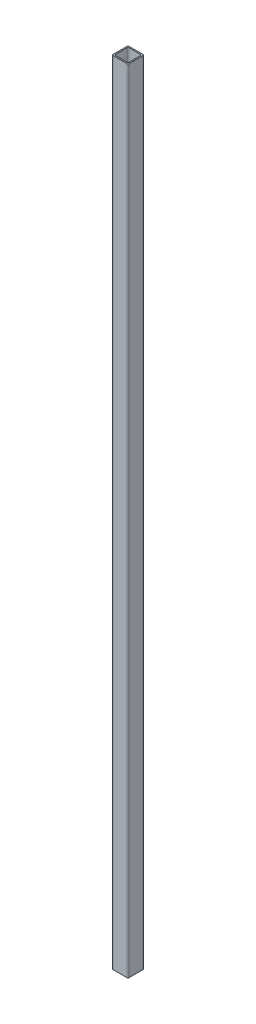
from build123d import *

# Parameters (mm, degrees)
BOSS_EXTRUDE1_DEPTH = 1210
SKETCH2_W           = 101.895059676
SKETCH2_H           = 138.127514373
CUT_EXTRUDE1_DEPTH  = 220


with BuildPart() as part:
    # Sketch1 → Boss-Extrude1 (new body)
    with BuildSketch(Plane(origin=(0, 0, 0), x_dir=(1, 0, 0), z_dir=(0, 1, 0))):
        with BuildLine():
            Line((-9, -10), (9, -10))
            ThreePointArc((9, -10), (9.707106781, -9.707106781), (10, -9))
            Line((10, -9), (10, 9))
            ThreePointArc((10, 9), (9.707106781, 9.707106781), (9, 10))
            Line((9, 10), (-9, 10))
            ThreePointArc((-9, 10), (-9.707106781, 9.707106781), (-10, 9))
            Line((-10, 9), (-10, -9))
            ThreePointArc((-10, -9), (-9.707106781, -9.707106781), (-9, -10))
        make_face()
        with BuildLine():
            Line((-7.5, -8.5), (7.5, -8.5))
            ThreePointArc((7.5, -8.5), (8.207106781, -8.207106781), (8.5, -7.5))
            Line((8.5, -7.5), (8.5, 7.5))
            ThreePointArc((8.5, 7.5), (8.207106781, 8.207106781), (7.5, 8.5))
            Line((7.5, 8.5), (-7.5, 8.5))
            ThreePointArc((-7.5, 8.5), (-8.207106781, 8.207106781), (-8.5, 7.5))
            Line((-8.5, 7.5), (-8.5, -7.5))
            ThreePointArc((-8.5, -7.5), (-8.207106781, -8.207106781), (-7.5, -8.5))
        make_face(mode=Mode.SUBTRACT)
    extrude(amount=BOSS_EXTRUDE1_DEPTH)

    # Sketch2 → Cut-Extrude1 (cut)
    with BuildSketch(Plane.XZ):
        with Locations((4.315799724, -16.6218454)):
            Rectangle(SKETCH2_W, SKETCH2_H)
    extrude(amount=-CUT_EXTRUDE1_DEPTH, mode=Mode.SUBTRACT)


solid = part.part
